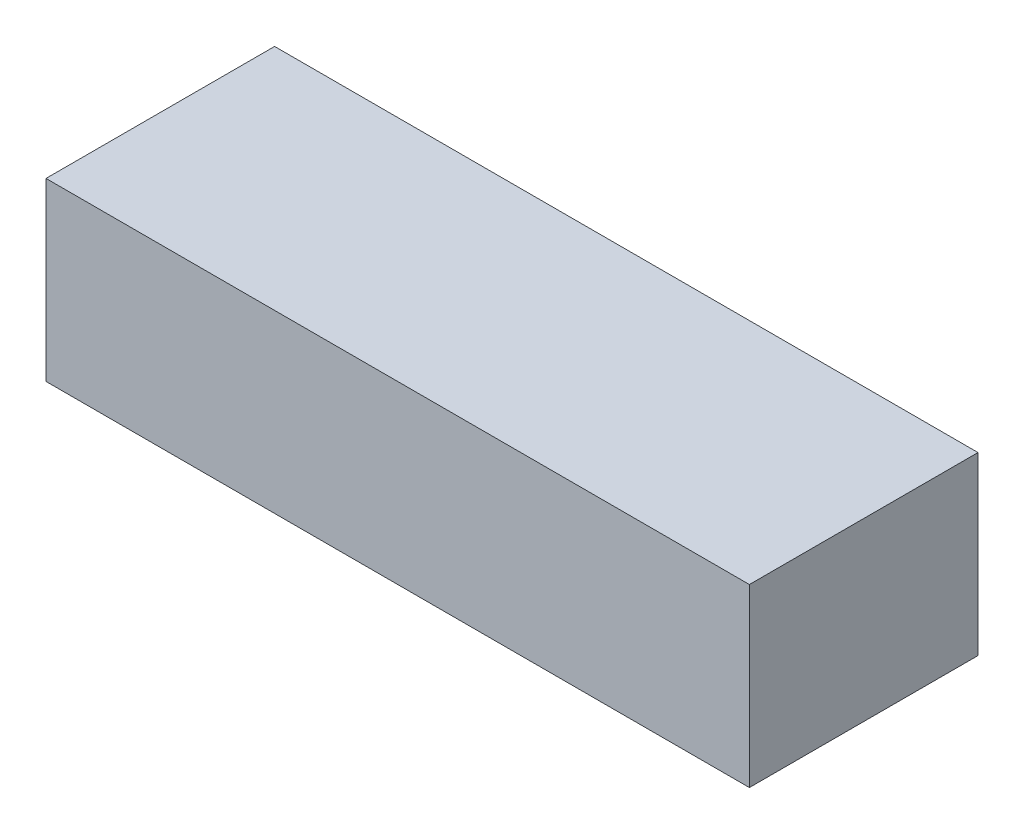
from build123d import *

# Parameters (mm, degrees)
SKETCH1_W           = 40
SKETCH1_H           = 13
BOSS_EXTRUDE1_DEPTH = 10


with BuildPart() as part:
    # Sketch1 → Boss-Extrude1 (new body)
    with BuildSketch(Plane(origin=(0, 0, 0), x_dir=(1, 0, 0), z_dir=(0, 1, 0))):
        with Locations((20, 6.5)):
            Rectangle(SKETCH1_W, SKETCH1_H)
    extrude(amount=-BOSS_EXTRUDE1_DEPTH)


solid = part.part
